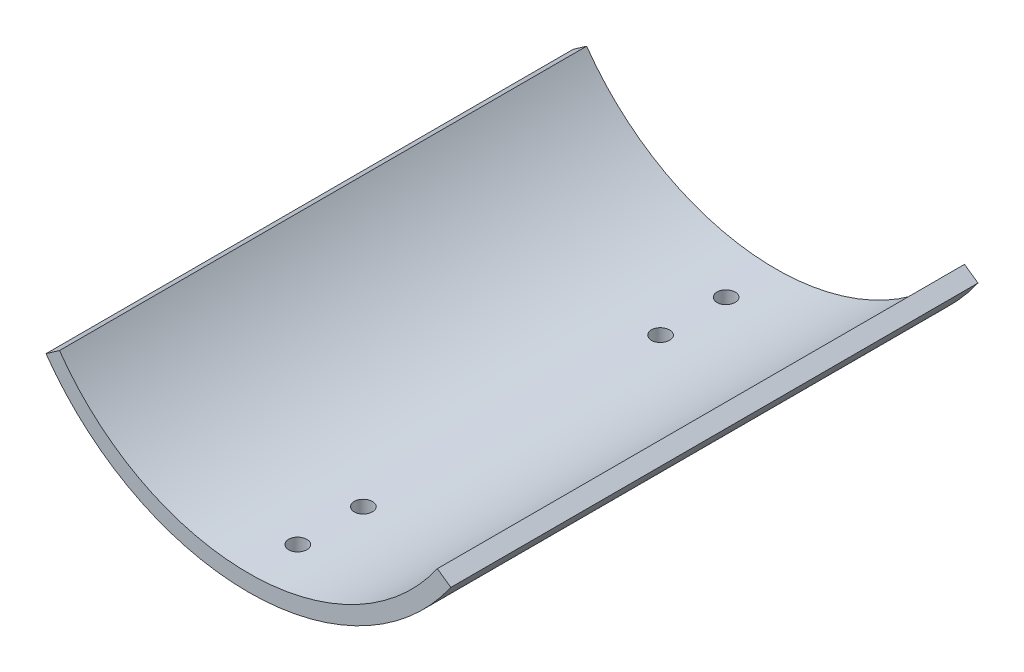
from build123d import *

# Parameters (mm, degrees)
BOSS_EXTRUDE1_DEPTH      = 50.8
BOSS_EXTRUDE1_DEPTH_BACK = 50.8
SKETCH3_R                = 1.7526
CUT_EXTRUDE1_DEPTH       = 96


with BuildPart() as part:
    # Sketch1 → Boss-Extrude1 (new, two sides: drawn at the far end of the back side and taken through both)
    with BuildSketch(Plane.XY.offset(-BOSS_EXTRUDE1_DEPTH_BACK)):
        with BuildLine():
            ThreePointArc((36.411308369, -25.495472596), (0, -44.45), (-36.411308369, -25.495472596))
            Line((-36.411308369, -25.495472596), (-39.012116109, -27.316577781))
            ThreePointArc((-39.012116109, -27.316577781), (0, -47.625), (39.012116109, -27.316577781))
            Line((39.012116109, -27.316577781), (36.411308369, -25.495472596))
        make_face()
    extrude(amount=BOSS_EXTRUDE1_DEPTH + BOSS_EXTRUDE1_DEPTH_BACK)

    # Sketch3 → Cut-Extrude1 (cut)
    with BuildSketch(Plane(origin=(0, 0, 0), x_dir=(1, 0, 0), z_dir=(0, 1, 0))):
        with Locations((0, 41.275)):
            Circle(SKETCH3_R)
        with Locations((0, 28.636263)):
            Circle(SKETCH3_R)
        with Locations((0, -28.636263)):
            Circle(SKETCH3_R)
        with Locations((0, -41.275)):
            Circle(SKETCH3_R)
    extrude(amount=-CUT_EXTRUDE1_DEPTH, mode=Mode.SUBTRACT)


solid = part.part
